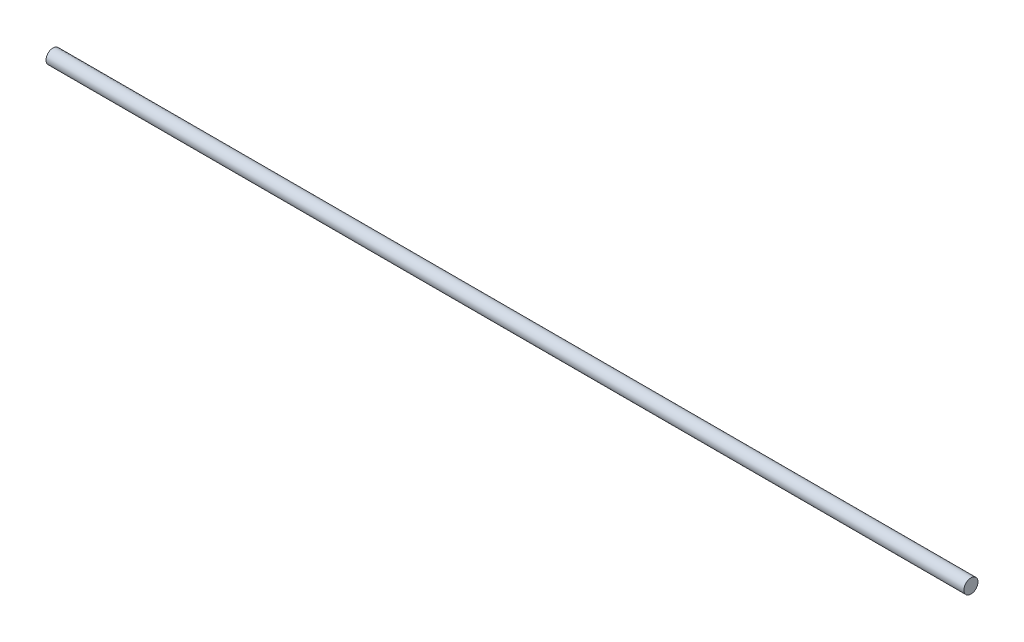
from build123d import *

# Parameters (mm, degrees)
SKETCH_1_R      = 1
EXTRUDE_1_DEPTH = 130


with BuildPart() as part:
    # 草图1 → 凸台-拉伸1 (new body)
    with BuildSketch(Plane(origin=(0, 0, 0), x_dir=(0, 0, -1), z_dir=(1, 0, 0))):
        Circle(SKETCH_1_R)
    extrude(amount=EXTRUDE_1_DEPTH)


solid = part.part
